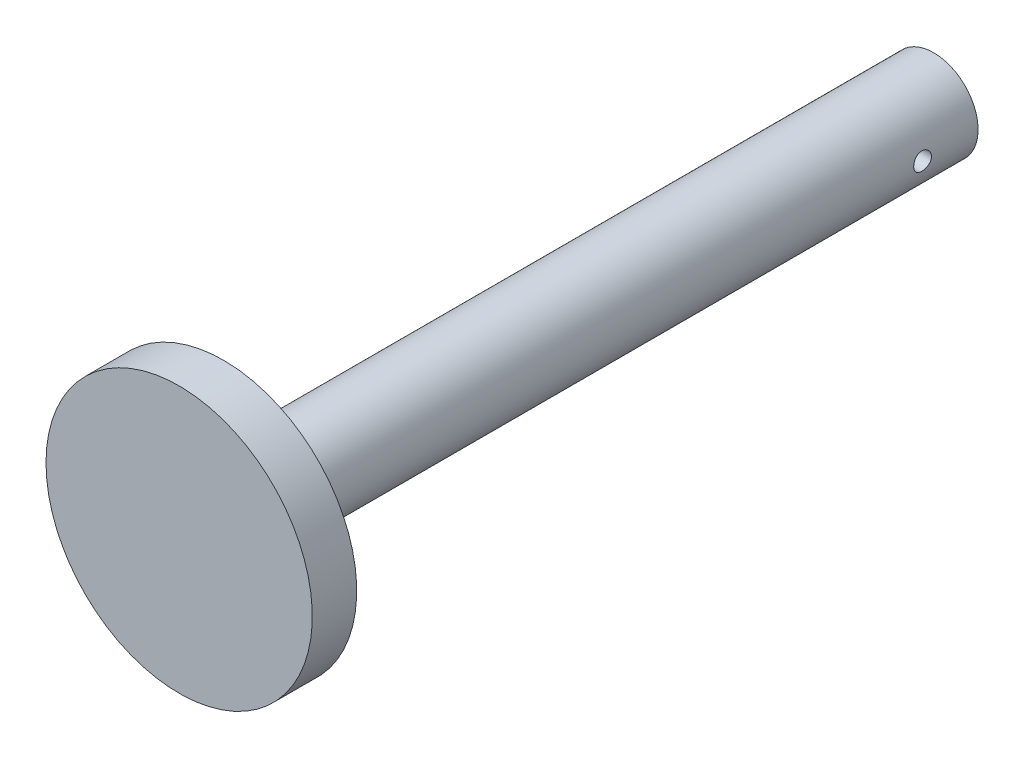
from build123d import *

# Parameters (mm, degrees)
CUT_EXTRUDE1_DEPTH      = 88.60707734
CUT_EXTRUDE1_DEPTH_BACK = 88.60707734
SKETCH2_R               = 1


with BuildPart() as part:
    # Sketch1 → Revolve1 (revolve)
    with BuildSketch(Plane(origin=(0, 0, 0), x_dir=(0, 0, -1), z_dir=(1, 0, 0)), mode=Mode.PRIVATE) as revolve1_sk:
        Polygon((0, 0), (0, -15), (5, -15), (5, -5), (85, -5), (85, 0), align=None)
    revolve(revolve1_sk.sketch.rotate(Axis((0, 0, -85), (0, 0, 1)), 270), axis=Axis((0, 0, -85), (0, 0, 1)))

    # Sketch2 → Cut-Extrude1 (cut, two sides: drawn at the far end of the back side and taken through both)
    with BuildSketch(Plane(origin=(0, 0, 0), x_dir=(0, 0, -1), z_dir=(1, 0, 0)).offset(-CUT_EXTRUDE1_DEPTH_BACK)):
        with Locations((78.75, 0)):
            Circle(SKETCH2_R)
    extrude(amount=CUT_EXTRUDE1_DEPTH + CUT_EXTRUDE1_DEPTH_BACK, mode=Mode.SUBTRACT)


solid = part.part
